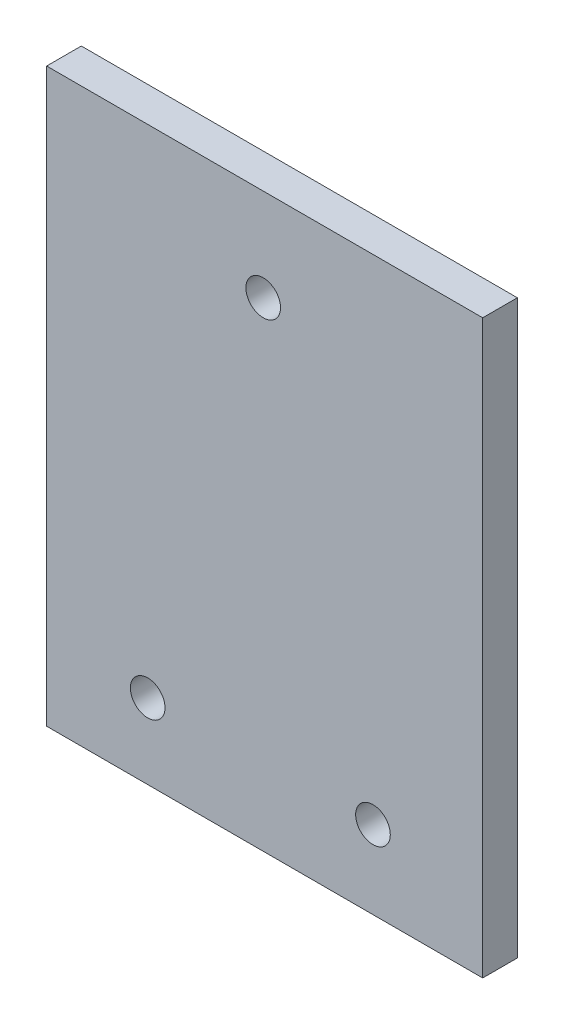
from build123d import *

# Parameters (mm, degrees)
SKETCH1_W           = 151
SKETCH1_H           = 198
BOSS_EXTRUDE1_DEPTH = 12
SKETCH2_R           = 6
CUT_EXTRUDE1_DEPTH  = 12


with BuildPart() as part:
    # Sketch1 → Boss-Extrude1 (new body)
    with BuildSketch(Plane.XY):
        with Locations((75.5, -99)):
            Rectangle(SKETCH1_W, SKETCH1_H)
    extrude(amount=BOSS_EXTRUDE1_DEPTH)

    # Sketch2 → Cut-Extrude1 (cut)
    with BuildSketch(Plane.XY.offset(12)):
        with Locations((75, -32)):
            Circle(SKETCH2_R)
        with Locations((35, -172)):
            Circle(SKETCH2_R)
        with Locations((113, -171)):
            Circle(SKETCH2_R)
    extrude(amount=-CUT_EXTRUDE1_DEPTH, mode=Mode.SUBTRACT)


solid = part.part
